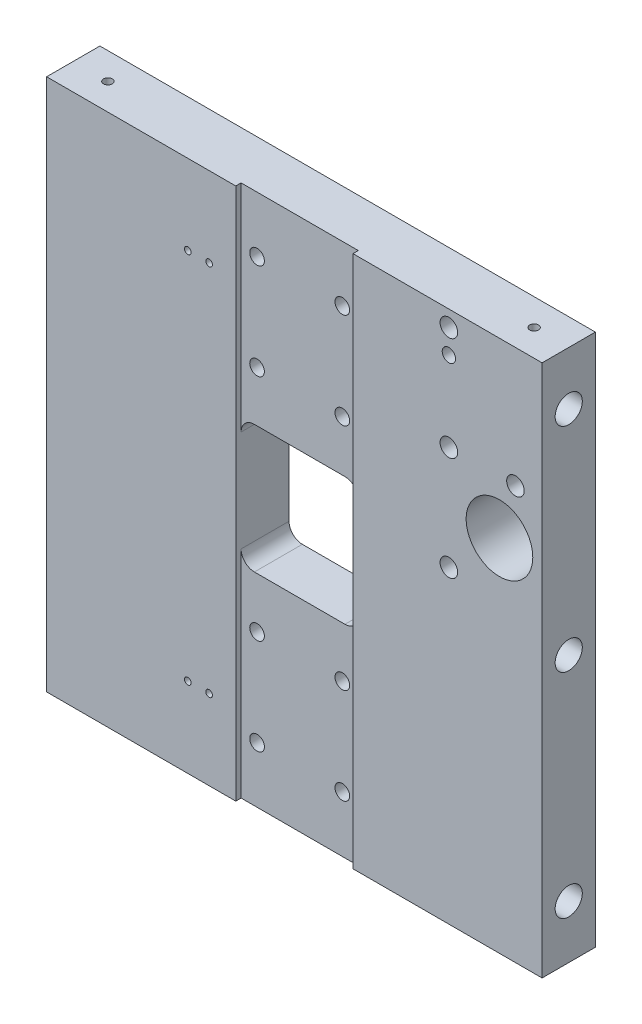
from build123d import *

# Parameters (mm, degrees)
SKETCH_1_W                   = 186
SKETCH_1_H                   = 200
EXTRUDE_1_DEPTH              = 20
HOLE_WIZARD_M12_1_AT_2_COUNT = 2
HOLE_WIZARD_M12_1_AT_2_PITCH = 80
HOLE_WIZARD_M12_1_AT_3_COUNT = 2
HOLE_WIZARD_M12_1_AT_3_PITCH = 160
SKETCH_4_W                   = 44
SKETCH_4_H                   = 200
CUT_EXTRUDE_1_DEPTH          = 2
HOLE_WIZARD_2_D              = 5.5
HOLE_WIZARD_2_CBORE_D        = 10
HOLE_WIZARD_2_CBORE_DEPTH    = 6.5
HOLE_WIZARD_2_2_D            = 6.6
HOLE_WIZARD_2_2_CBORE_D      = 11
HOLE_WIZARD_2_2_CBORE_DEPTH  = 6.8
HOLE_WIZARD_M4_1_D           = 3.3
HOLE_WIZARD_M4_1_DEPTH       = 10.1
HOLE_WIZARD_M4_1_TIP         = 0.991420021
CUT_EXTRUDE_2_DEPTH          = 139.018114753
HOLE_WIZARD_M4_2_D           = 3.3
HOLE_WIZARD_M4_2_DEPTH       = 10.1
HOLE_WIZARD_M4_2_TIP         = 0.991420021
HOLE_WIZARD_M3_1_D           = 2.5
HOLE_WIZARD_M3_1_DEPTH       = 7.5
HOLE_WIZARD_M3_1_TIP         = 0.751075774
HOLE_WIZARD_1_D              = 25
HOLE_WIZARD_M6_1_D           = 5


with BuildPart() as part:
    # 草图1 → 凸台-拉伸1 (new body)
    with BuildSketch(Plane.XY):
        Rectangle(SKETCH_1_W, SKETCH_1_H)
    extrude(amount=EXTRUDE_1_DEPTH)

    # 草图2 → M12 螺纹孔1 (revolve, cut)
    with BuildSketch(Plane(origin=(-93, 80, 10), x_dir=(0, 0, 1), z_dir=(0, 1, 0))):
        Polygon((0, 0), (0, 30.064389157), (5.1, 27), (5.1, 0), align=None)
    hole_wizard_m12_1 = revolve(axis=Axis((-99.35, 80, 10), (1, 0, 0)), mode=Mode.SUBTRACT)

    # M12 螺纹孔1 at 2: M12 螺纹孔1 ×2
    with Locations(*[(0, -i * HOLE_WIZARD_M12_1_AT_2_PITCH, 0) for i in range(1, HOLE_WIZARD_M12_1_AT_2_COUNT)]):
        add(hole_wizard_m12_1, mode=Mode.SUBTRACT)

    # M12 螺纹孔1 at 3: M12 螺纹孔1 ×2
    with Locations(*[(0, -i * HOLE_WIZARD_M12_1_AT_3_PITCH, 0) for i in range(1, HOLE_WIZARD_M12_1_AT_3_COUNT)]):
        add(hole_wizard_m12_1, mode=Mode.SUBTRACT)

    # 镜向1: M12 螺纹孔1 across plane
    add(hole_wizard_m12_1.mirror(Plane(origin=(0, 0, 0), x_dir=(0, 0, 1), z_dir=(1, 0, 0))), mode=Mode.SUBTRACT)

    # 镜向1 copy 1 sketch → 镜向1 copy 1 (revolve, cut)
    with BuildSketch(Plane(origin=(93, 0, 10), x_dir=(0, 0, 1), z_dir=(0, 1, 0))):
        Polygon((0, 0), (0, -30.064389157), (5.1, -27), (5.1, 0), align=None)
    revolve(axis=Axis((99.35, 0, 10), (1, 0, 0)), mode=Mode.SUBTRACT)

    # 镜向1 copy 2 sketch → 镜向1 copy 2 (revolve, cut)
    with BuildSketch(Plane(origin=(93, -80, 10), x_dir=(0, 0, 1), z_dir=(0, 1, 0))):
        Polygon((0, 0), (0, -30.064389157), (5.1, -27), (5.1, 0), align=None)
    revolve(axis=Axis((99.35, -80, 10), (1, 0, 0)), mode=Mode.SUBTRACT)

    # 草图4 → 切除-拉伸1 (cut)
    with BuildSketch(Plane.XY.offset(20)):
        Rectangle(SKETCH_4_W, SKETCH_4_H)
    extrude(amount=-CUT_EXTRUDE_1_DEPTH, mode=Mode.SUBTRACT)

    # Hole Wizard 2 (through all)
    with Locations(Plane(origin=(0, 0, 0), x_dir=(-1, 0, 0), z_dir=(0, 0, -1))):
        with Locations((16, 79), (16, 43), (-16, 43), (-16, 79), (-16, -79), (-16, -43), (16, -43), (16, -79)):
            CounterBoreHole(HOLE_WIZARD_2_D / 2, HOLE_WIZARD_2_CBORE_D / 2, HOLE_WIZARD_2_CBORE_DEPTH)

    # Hole Wizard 2 2 (through all)
    with Locations(Plane(origin=(0, 0, 0), x_dir=(-1, 0, 0), z_dir=(0, 0, -1))):
        with Locations((-58, 94), (-58, 55), (-58, 16), (-83, 55)):
            CounterBoreHole(HOLE_WIZARD_2_2_D / 2, HOLE_WIZARD_2_2_CBORE_D / 2, HOLE_WIZARD_2_2_CBORE_DEPTH)

    # M4 螺纹孔1
    with Locations(Plane(origin=(0, 100, 0), x_dir=(1, 0, 0), z_dir=(0, 1, 0))):
        with Locations((-80, -10), (80, -10)):
            Hole(HOLE_WIZARD_M4_1_D / 2, depth=HOLE_WIZARD_M4_1_DEPTH)
            with Locations((0, 0, -(HOLE_WIZARD_M4_1_DEPTH + HOLE_WIZARD_M4_1_TIP / 2))):  # 118° drill point
                Cone(0, HOLE_WIZARD_M4_1_D / 2, HOLE_WIZARD_M4_1_TIP, mode=Mode.SUBTRACT)

    # 草图11 → 切除-拉伸2 (cut, through all)
    with BuildSketch(Plane(origin=(0, 0, 0), x_dir=(-1, 0, 0), z_dir=(0, 0, -1))):
        with BuildLine():
            Line((-17, -24), (17, -24))
            ThreePointArc((17, -24), (20.535533906, -22.535533906), (22, -19))
            Line((22, -19), (22, 19))
            ThreePointArc((22, 19), (20.535533906, 22.535533906), (17, 24))
            Line((17, 24), (-17, 24))
            ThreePointArc((-17, 24), (-20.535533906, 22.535533906), (-22, 19))
            Line((-22, 19), (-22, -19))
            ThreePointArc((-22, -19), (-20.535533906, -22.535533906), (-17, -24))
        make_face()
    extrude(amount=-CUT_EXTRUDE_2_DEPTH, mode=Mode.SUBTRACT)

    # M4 螺纹孔2
    with Locations(Plane(origin=(0, 0, 0), x_dir=(-1, 0, 0), z_dir=(0, 0, -1))):
        with Locations((-12.5, 65), (12.5, 65)):
            Hole(HOLE_WIZARD_M4_2_D / 2, depth=HOLE_WIZARD_M4_2_DEPTH)
            with Locations((0, 0, -(HOLE_WIZARD_M4_2_DEPTH + HOLE_WIZARD_M4_2_TIP / 2))):  # 118° drill point
                Cone(0, HOLE_WIZARD_M4_2_D / 2, HOLE_WIZARD_M4_2_TIP, mode=Mode.SUBTRACT)

    # M3 螺纹孔1
    with Locations(Plane.XY.offset(20)):
        with Locations((-32, 70), (-32, -70), (-40, -70), (-40, 70)):
            Hole(HOLE_WIZARD_M3_1_D / 2, depth=HOLE_WIZARD_M3_1_DEPTH)
            with Locations((0, 0, -(HOLE_WIZARD_M3_1_DEPTH + HOLE_WIZARD_M3_1_TIP / 2))):  # 118° drill point
                Cone(0, HOLE_WIZARD_M3_1_D / 2, HOLE_WIZARD_M3_1_TIP, mode=Mode.SUBTRACT)

    # 孔1 (through all)
    with Locations(Plane.XY.offset(20)):
        with Locations((77, 35)):
            Hole(HOLE_WIZARD_1_D / 2)

    # M6 螺纹孔1 (through all)
    with Locations(Plane(origin=(0, 0, 0), x_dir=(-1, 0, 0), z_dir=(0, 0, -1))):
        with Locations((-58, 85)):
            Hole(HOLE_WIZARD_M6_1_D / 2)


solid = part.part
